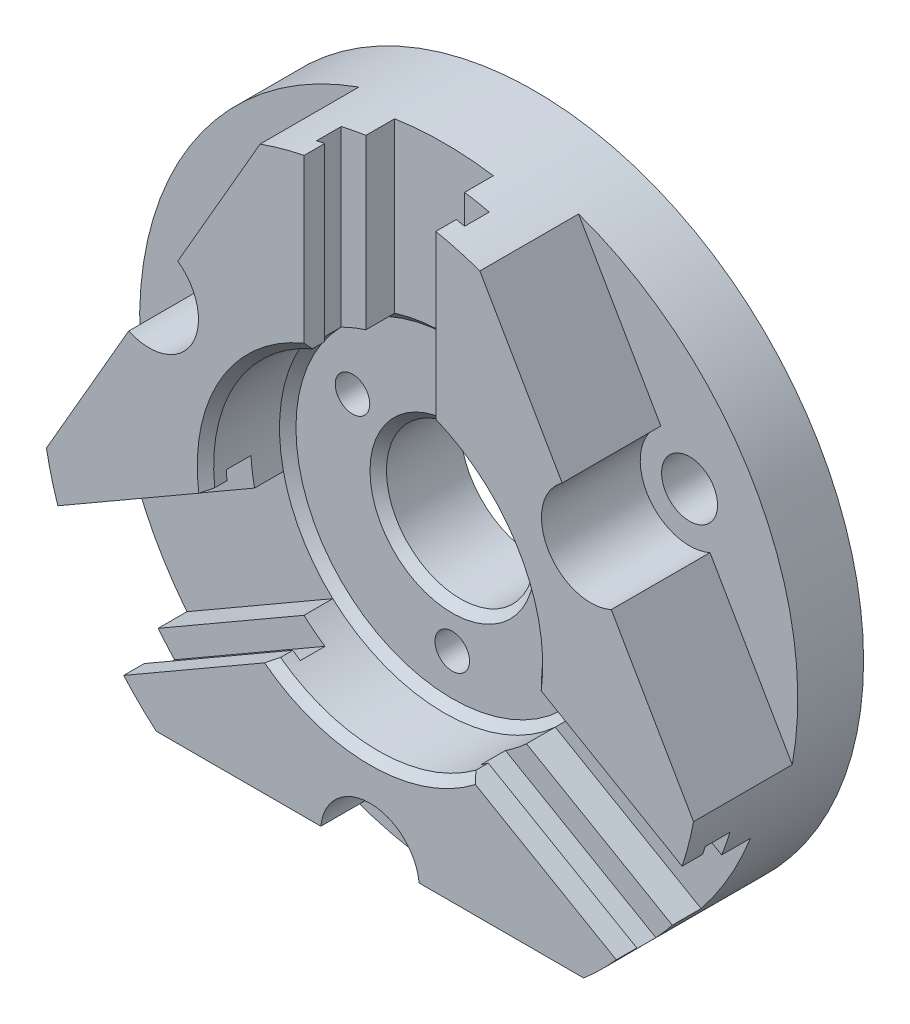
from build123d import *

# Parameters (mm, degrees)
SKETCH1_R               = 40
BOSS_EXTRUDE1_DEPTH     = 20
CUT_EXTRUDE1_START      = -12
CUT_EXTRUDE1_DEPTH      = 12
CIRPATTERN1_COUNT       = 3
CIRPATTERN2_COUNT       = 3
CIRPATTERN3_COUNT       = 3
M6_TAPPED_HOLE2_D       = 5
CHAMFER1_SIZE           = 1
CUT_EXTRUDE2_REACH      = 62
CUT_EXTRUDE2_END_RADIUS = 40
CIRPATTERN4_COUNT       = 3
CHAMFER2_SIZE           = 1


with BuildPart() as part:
    # Sketch1 → Boss-Extrude1 (new body)
    with BuildSketch(Plane.XY):
        Circle(SKETCH1_R)
    extrude(amount=BOSS_EXTRUDE1_DEPTH)

    # Sketch2 → Cut-Extrude1 (cut)
    with BuildSketch(Plane.XY.offset(20).offset(CUT_EXTRUDE1_START)):
        with BuildLine():
            Line((-39.331070493, -7.284702732), (-29.329853145, 10.037913852))
            ThreePointArc((-29.329853145, 10.037913852), (-21.650635095, 12.5), (-23.358014969, 20.381440987))
            Line((-23.358014969, 20.381440987), (-13.356797621, 37.704057571))
            ThreePointArc((-13.356797621, 37.704057571), (-34.641016151, 20), (-39.331070493, -7.284702732))
        make_face()
    cut_extrude1 = extrude(amount=CUT_EXTRUDE1_DEPTH, mode=Mode.SUBTRACT)

    # CirPattern1: Cut-Extrude1 ×3 about axis
    cirpattern1_axis = Axis((0, 0, 0), (0, 0, 1))
    for i in range(1, CIRPATTERN1_COUNT):
        add(cut_extrude1.rotate(cirpattern1_axis, i * 360 / CIRPATTERN1_COUNT), mode=Mode.SUBTRACT)

    # Sketch3 → Cut-Revolve1 (revolve, cut)
    with BuildSketch(Plane(origin=(0, 0, 0), x_dir=(0, 0, -1), z_dir=(1, 0, 0)), mode=Mode.PRIVATE) as cut_revolve1_sk:
        Polygon((-20, 0), (-20, 20), (-10, 20), (-10, 9), (0, 9), (0, 0), align=None)
    revolve(cut_revolve1_sk.sketch.rotate(Axis((0, 0, 0), (0, 0, 1)), 90), axis=Axis((0, 0, 0), (0, 0, 1)), mode=Mode.SUBTRACT)

    # Sketch7 → M5 Tapped Hole1 (revolve, cut)
    with BuildSketch(Plane(origin=(0, -14, 10), x_dir=(0, -1, 0), z_dir=(1, 0, 0))):
        Polygon((0, 0), (0, 14), (2.1, 12.7381927), (2.1, 0), align=None)
    m5_tapped_hole1 = revolve(axis=Axis((0, -14, 16.35), (0, 0, -1)), mode=Mode.SUBTRACT)

    # CirPattern2: M5 Tapped Hole1 ×3 about axis
    cirpattern2_axis = Axis((0, 0, 0), (0, 0, 1))
    for i in range(1, CIRPATTERN2_COUNT):
        add(m5_tapped_hole1.rotate(cirpattern2_axis, i * 360 / CIRPATTERN2_COUNT), mode=Mode.SUBTRACT)

    # Sketch9 → M8 Tapped Hole1 (revolve, cut)
    with BuildSketch(Plane(origin=(-26.846787517, 15.5, 8), x_dir=(0, -1, 0), z_dir=(1, 0, 0))):
        Polygon((0, 0), (0, 22.25), (3.4, 20.207073895), (3.4, 0), align=None)
    m8_tapped_hole1 = revolve(axis=Axis((-26.846787517, 15.5, 14.35), (0, 0, -1)), mode=Mode.SUBTRACT)

    # CirPattern3: M8 Tapped Hole1 ×3 about axis
    cirpattern3_axis = Axis((0, 0, 0), (0, 0, 1))
    for i in range(1, CIRPATTERN3_COUNT):
        add(m8_tapped_hole1.rotate(cirpattern3_axis, i * 360 / CIRPATTERN3_COUNT), mode=Mode.SUBTRACT)

    # M6 Tapped Hole2 (through all)
    with Locations(Plane.XY.offset(20)):
        with Locations((25.980762114, -15)):
            Hole(M6_TAPPED_HOLE2_D / 2)

    # Chamfer1
    chamfer1_edges = [part.edges().sort_by_distance(p)[0] for p in [
        (20, 0, 20),
        (20, 0, 10),
    ]]
    chamfer(chamfer1_edges, length=CHAMFER1_SIZE)

    # Cut-Extrude2: up to this cylinder (the profile starts inside it)
    cut_extrude2_end = Plane(origin=(0, 0, 15.805147), z_dir=(0, 0, -1)) * Cylinder(CUT_EXTRUDE2_END_RADIUS, 205, mode=Mode.PRIVATE)
    # Sketch12 → Cut-Extrude2 (cut, up to the surface)
    with BuildSketch(Plane(origin=(0, 0, 0), x_dir=(1, 0, 0), z_dir=(0, 1, 0)), mode=Mode.PRIVATE) as cut_extrude2_sk1:
        Polygon((8, -20), (8, -17.5), (9, -17.5), (9, -14.5), (6, -14.5), (6, -11), (-6, -11), (-6, -14.5), (-9, -14.5), (-9, -17.5), (-8, -17.5), (-8, -20), align=None)
    cut_extrude2_tool1 = extrude(cut_extrude2_sk1.sketch, amount=CUT_EXTRUDE2_REACH, mode=Mode.PRIVATE) & cut_extrude2_end
    cut_extrude2 = cut_extrude2_tool1.solids().sort_by_distance((0, 0, 15.805147))[0]
    add(cut_extrude2, mode=Mode.SUBTRACT)

    # CirPattern4: Cut-Extrude2 ×3 about axis
    cirpattern4_axis = Axis((0, 0, 0), (0, 0, 1))
    for i in range(1, CIRPATTERN4_COUNT):
        add(cut_extrude2.rotate(cirpattern4_axis, i * 360 / CIRPATTERN4_COUNT), mode=Mode.SUBTRACT)

    # Chamfer2
    chamfer2_edges = [part.edges().sort_by_distance(p)[0] for p in [
        (9, 0, 10),
    ]]
    chamfer(chamfer2_edges, length=CHAMFER2_SIZE)


solid = part.part
